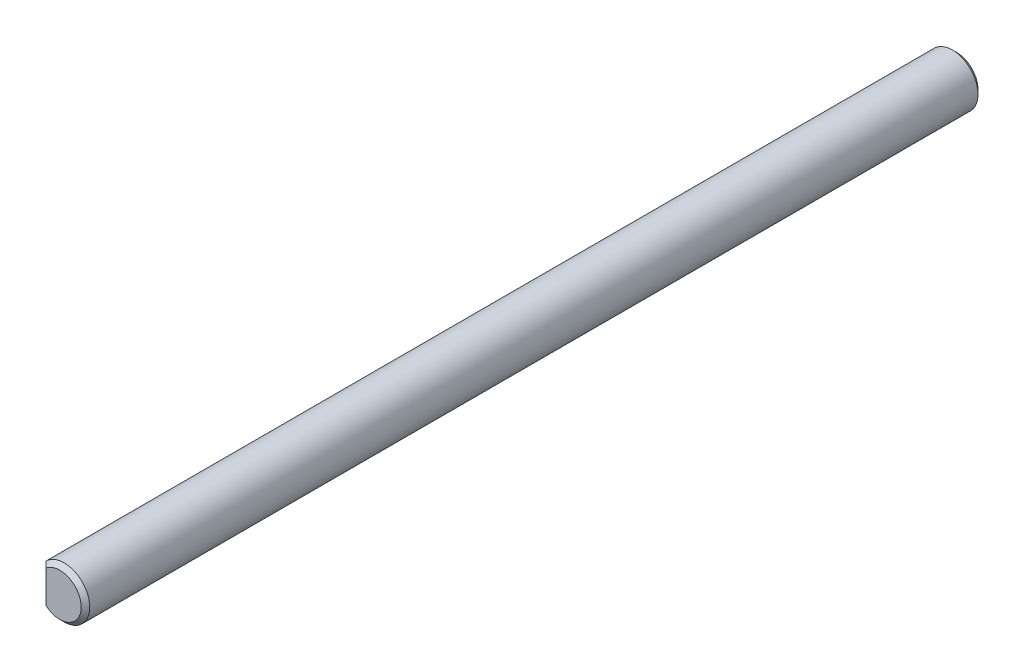
from build123d import *

# Parameters (mm, degrees)
SKETCH_1_R          = 3
EXTRUDE_1_DEPTH     = 105
CUT_EXTRUDE_1_DEPTH = 30
CUT_EXTRUDE_START   = -10
CUT_EXTRUDE_2_DEPTH = 10
M3X0_5_1_D          = 2.5
M3X0_5_1_DEPTH      = 10
M3X0_5_1_TIP        = 0.751075774
CHAMFER_1_SIZE      = 0.5


with BuildPart() as part:
    # 草图1 → 凸台-拉伸1 (new body)
    with BuildSketch(Plane.XY):
        Circle(SKETCH_1_R)
    extrude(amount=EXTRUDE_1_DEPTH)

    # 草图2 → 切除-拉伸1 (cut)
    with BuildSketch(Plane(origin=(0, 0, 0), x_dir=(-1, 0, 0), z_dir=(0, 0, -1))):
        with BuildLine():
            ThreePointArc((3, 0), (2.771638598, 1.148050297), (2.121320344, 2.121320344))
            Line((2.121320344, 2.121320344), (2.121320344, -2.121320344))
            ThreePointArc((2.121320344, -2.121320344), (2.771638598, -1.148050297), (3, 0))
        make_face()
    extrude(amount=-CUT_EXTRUDE_1_DEPTH, mode=Mode.SUBTRACT)

    # 草图3 → 切除-拉伸2 (cut)
    with BuildSketch(Plane.XY.offset(105).offset(CUT_EXTRUDE_START)):
        with BuildLine():
            Line((-2.121320344, -2.121320344), (-2.121320344, 2.121320344))
            ThreePointArc((-2.121320344, 2.121320344), (-3, 0), (-2.121320344, -2.121320344))
        make_face()
    extrude(amount=CUT_EXTRUDE_2_DEPTH, mode=Mode.SUBTRACT)

    # M3x0.5 螺纹孔1
    with Locations(Plane(origin=(0, 0, 0), x_dir=(-1, 0, 0), z_dir=(0, 0, -1))):
        with Locations((0, 0)):
            Hole(M3X0_5_1_D / 2, depth=M3X0_5_1_DEPTH)
            with Locations((0, 0, -(M3X0_5_1_DEPTH + M3X0_5_1_TIP / 2))):  # 118° drill point
                Cone(0, M3X0_5_1_D / 2, M3X0_5_1_TIP, mode=Mode.SUBTRACT)

    # 倒角1
    chamfer_1_edges = [part.edges().sort_by_distance(p)[0] for p in [
        (1.148050297, -2.771638598, 105),
        (-2.121320344, 0, 105),
        (1.148050297, 2.771638598, 0),
        (-2.121320344, 0, 0),
    ]]
    chamfer(chamfer_1_edges, length=CHAMFER_1_SIZE)


solid = part.part
